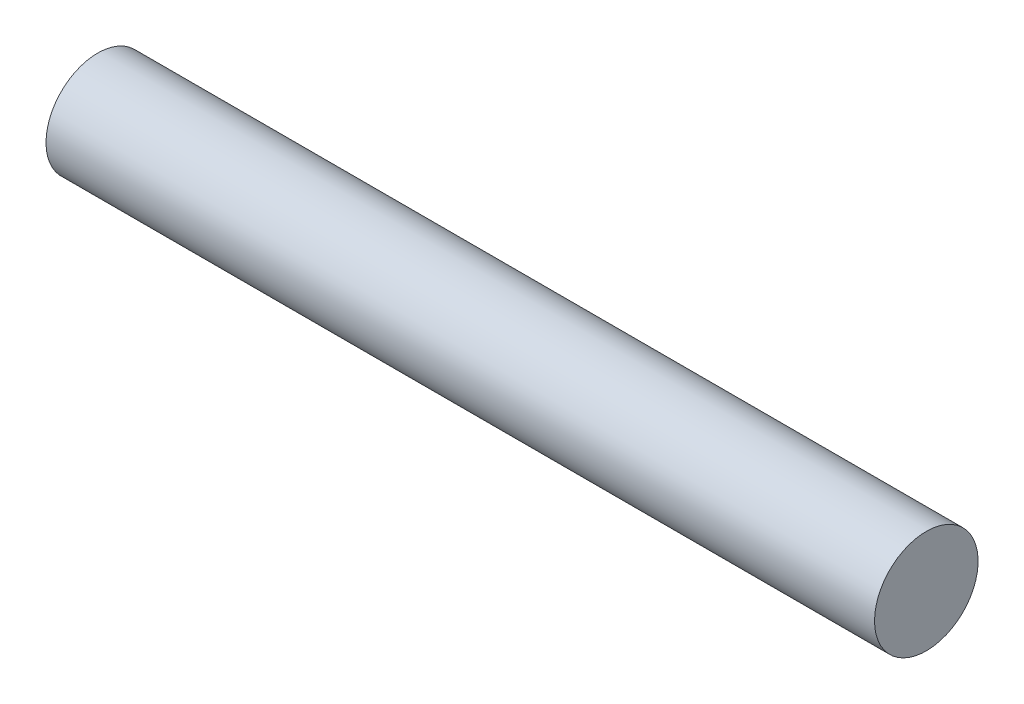
from build123d import *

# Parameters (mm, degrees)
CROQUIS2_R              = 2.38125
SALIENTE_EXTRUIR1_DEPTH = 19.05


with BuildPart() as part:
    # Croquis2 → Saliente-Extruir1 (new, symmetric)
    with BuildSketch(Plane(origin=(0, 0, 0), x_dir=(0, 0, -1), z_dir=(1, 0, 0))):
        with Locations(Location((0, 0, 0), (0, 0, 180))):
            Circle(CROQUIS2_R)
    extrude(amount=SALIENTE_EXTRUIR1_DEPTH, both=True)


solid = part.part
